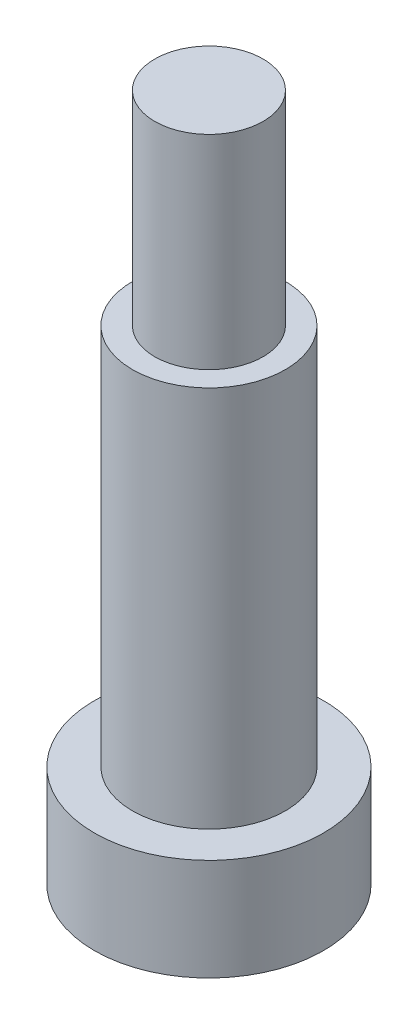
from build123d import *

# Parameters (mm, degrees)
ROSCA_M10_START  = -10.35
CROQUIS1_R       = 4.25
ROSCA_M10_DEPTH  = 16
HOMBRO_D12_START = -40.35
CROQUIS2_R       = 6
HOMBRO_D12_DEPTH = 30
CABEZA_START     = -48.35
CROQUIS3_R       = 9
CABEZA_DEPTH     = 8
ALLEN_START      = -48.35
CROQUIS4_R       = 3.96
ALLEN_DEPTH      = 4.8


with BuildPart() as part:
    # Croquis1 → Rosca_M10 (new body)
    with BuildSketch(Plane(origin=(0, 0, 0), x_dir=(1, 0, 0), z_dir=(0, 1, 0)).offset(ROSCA_M10_START)):
        with Locations(Location((0, -171.45, 0), (0, 0, 270))):
            Circle(CROQUIS1_R)
    extrude(amount=ROSCA_M10_DEPTH)

    # Croquis2 → Hombro_D12 (add)
    with BuildSketch(Plane(origin=(0, 0, 0), x_dir=(1, 0, 0), z_dir=(0, 1, 0)).offset(HOMBRO_D12_START)):
        with Locations(Location((0, -171.45, 0), (0, 0, 270))):
            Circle(CROQUIS2_R)
    extrude(amount=HOMBRO_D12_DEPTH)

    # Croquis3 → Cabeza (add)
    with BuildSketch(Plane(origin=(0, 0, 0), x_dir=(1, 0, 0), z_dir=(0, 1, 0)).offset(CABEZA_START)):
        with Locations(Location((0, -171.45, 0), (0, 0, 270))):
            Circle(CROQUIS3_R)
    extrude(amount=CABEZA_DEPTH)

    # Croquis4 → Allen (cut)
    with BuildSketch(Plane(origin=(0, 0, 0), x_dir=(1, 0, 0), z_dir=(0, 1, 0)).offset(ALLEN_START)):
        with Locations(Location((0, -171.45, 0), (0, 0, 270))):
            Circle(CROQUIS4_R)
    extrude(amount=ALLEN_DEPTH, mode=Mode.SUBTRACT)


solid = part.part
